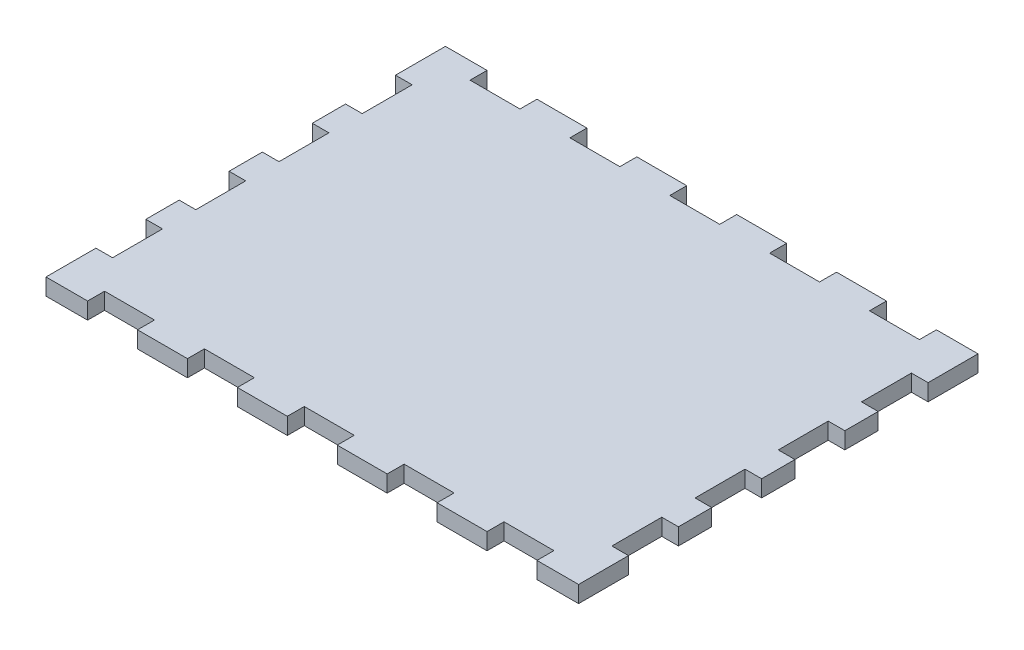
from build123d import *

# Parameters (mm, degrees)
SKETCH1_W               = 203.2
SKETCH1_H               = 152.4
BOSS_EXTRUDE1_DEPTH     = 3.175
SKETCH2_W               = 19.05
SKETCH2_H               = 6.477
CUT_EXTRUDE1_DEPTH      = 128.158650905
LPATTERN1_COUNT         = 5
LPATTERN1_PITCH         = 38.1
MIRROR1_COPY_1_SKETCH_W = 19.05
MIRROR1_COPY_1_SKETCH_H = 6.477
MIRROR1_COPY_1_DEPTH    = 128.158650905
MIRROR1_COPY_2_SKETCH_W = 19.05
MIRROR1_COPY_2_SKETCH_H = 6.477
MIRROR1_COPY_2_DEPTH    = 128.158650905
MIRROR1_COPY_3_SKETCH_W = 19.05
MIRROR1_COPY_3_SKETCH_H = 6.477
MIRROR1_COPY_3_DEPTH    = 128.158650905
MIRROR1_COPY_4_SKETCH_W = 19.05
MIRROR1_COPY_4_SKETCH_H = 6.477
MIRROR1_COPY_4_DEPTH    = 128.158650905
SKETCH3_W               = 6.35
SKETCH3_H               = 19.05
CUT_EXTRUDE2_DEPTH      = 128.158650905
LPATTERN2_COUNT         = 4
LPATTERN2_PITCH         = 31.75
MIRROR2_COPY_1_SKETCH_W = 6.35
MIRROR2_COPY_1_SKETCH_H = 19.05
MIRROR2_COPY_1_DEPTH    = 128.158650905
MIRROR2_COPY_2_SKETCH_W = 6.35
MIRROR2_COPY_2_SKETCH_H = 19.05
MIRROR2_COPY_2_DEPTH    = 128.158650905
MIRROR2_COPY_3_SKETCH_W = 6.35
MIRROR2_COPY_3_SKETCH_H = 19.05
MIRROR2_COPY_3_DEPTH    = 128.158650905


with BuildPart() as part:
    # Sketch1 → Boss-Extrude1 (new, symmetric)
    with BuildSketch(Plane(origin=(0, 0, 0), x_dir=(1, 0, 0), z_dir=(0, 1, 0))):
        Rectangle(SKETCH1_W, SKETCH1_H)
    extrude(amount=BOSS_EXTRUDE1_DEPTH, both=True)

    # Sketch2 → Cut-Extrude1 (cut, through all)
    with BuildSketch(Plane(origin=(0, 3.175, 0), x_dir=(1, 0, 0), z_dir=(0, 1, 0))):
        with Locations((76.2, 72.9615)):
            Rectangle(SKETCH2_W, SKETCH2_H)
    cut_extrude1 = extrude(amount=-CUT_EXTRUDE1_DEPTH, mode=Mode.SUBTRACT)

    # LPattern1: Cut-Extrude1 ×5
    with Locations(*[(-i * LPATTERN1_PITCH, 0, 0) for i in range(1, LPATTERN1_COUNT)]):
        add(cut_extrude1, mode=Mode.SUBTRACT)

    # Mirror1: Cut-Extrude1 across plane
    add(cut_extrude1.mirror(Plane.XY), mode=Mode.SUBTRACT)

    # Mirror1 copy 1 sketch → Mirror1 copy 1 (cut, through all)
    with BuildSketch(Plane(origin=(-38.1, 3.175, 0), x_dir=(1, 0, 0), z_dir=(0, 1, 0))):
        with Locations((76.2, -72.9615)):
            Rectangle(MIRROR1_COPY_1_SKETCH_W, MIRROR1_COPY_1_SKETCH_H)
    extrude(amount=-MIRROR1_COPY_1_DEPTH, mode=Mode.SUBTRACT)

    # Mirror1 copy 2 sketch → Mirror1 copy 2 (cut, through all)
    with BuildSketch(Plane(origin=(-76.2, 3.175, 0), x_dir=(1, 0, 0), z_dir=(0, 1, 0))):
        with Locations((76.2, -72.9615)):
            Rectangle(MIRROR1_COPY_2_SKETCH_W, MIRROR1_COPY_2_SKETCH_H)
    extrude(amount=-MIRROR1_COPY_2_DEPTH, mode=Mode.SUBTRACT)

    # Mirror1 copy 3 sketch → Mirror1 copy 3 (cut, through all)
    with BuildSketch(Plane(origin=(-114.3, 3.175, 0), x_dir=(1, 0, 0), z_dir=(0, 1, 0))):
        with Locations((76.2, -72.9615)):
            Rectangle(MIRROR1_COPY_3_SKETCH_W, MIRROR1_COPY_3_SKETCH_H)
    extrude(amount=-MIRROR1_COPY_3_DEPTH, mode=Mode.SUBTRACT)

    # Mirror1 copy 4 sketch → Mirror1 copy 4 (cut, through all)
    with BuildSketch(Plane(origin=(-152.4, 3.175, 0), x_dir=(1, 0, 0), z_dir=(0, 1, 0))):
        with Locations((76.2, -72.9615)):
            Rectangle(MIRROR1_COPY_4_SKETCH_W, MIRROR1_COPY_4_SKETCH_H)
    extrude(amount=-MIRROR1_COPY_4_DEPTH, mode=Mode.SUBTRACT)

    # Sketch3 → Cut-Extrude2 (cut, through all)
    with BuildSketch(Plane(origin=(0, 3.175, 0), x_dir=(1, 0, 0), z_dir=(0, 1, 0))):
        with Locations((-98.425, 47.625)):
            Rectangle(SKETCH3_W, SKETCH3_H)
    cut_extrude2 = extrude(amount=-CUT_EXTRUDE2_DEPTH, mode=Mode.SUBTRACT)

    # LPattern2: Cut-Extrude2 ×4
    with Locations(*[(0, 0, i * LPATTERN2_PITCH) for i in range(1, LPATTERN2_COUNT)]):
        add(cut_extrude2, mode=Mode.SUBTRACT)

    # Mirror2: Cut-Extrude2 across plane
    add(cut_extrude2.mirror(Plane(origin=(0, 0, 0), x_dir=(0, 0, 1), z_dir=(1, 0, 0))), mode=Mode.SUBTRACT)

    # Mirror2 copy 1 sketch → Mirror2 copy 1 (cut, through all)
    with BuildSketch(Plane(origin=(0, 3.175, 31.75), x_dir=(-1, 0, 0), z_dir=(0, 1, 0))):
        with Locations((-98.425, -47.625)):
            Rectangle(MIRROR2_COPY_1_SKETCH_W, MIRROR2_COPY_1_SKETCH_H)
    extrude(amount=-MIRROR2_COPY_1_DEPTH, mode=Mode.SUBTRACT)

    # Mirror2 copy 2 sketch → Mirror2 copy 2 (cut, through all)
    with BuildSketch(Plane(origin=(0, 3.175, 63.5), x_dir=(-1, 0, 0), z_dir=(0, 1, 0))):
        with Locations((-98.425, -47.625)):
            Rectangle(MIRROR2_COPY_2_SKETCH_W, MIRROR2_COPY_2_SKETCH_H)
    extrude(amount=-MIRROR2_COPY_2_DEPTH, mode=Mode.SUBTRACT)

    # Mirror2 copy 3 sketch → Mirror2 copy 3 (cut, through all)
    with BuildSketch(Plane(origin=(0, 3.175, 95.25), x_dir=(-1, 0, 0), z_dir=(0, 1, 0))):
        with Locations((-98.425, -47.625)):
            Rectangle(MIRROR2_COPY_3_SKETCH_W, MIRROR2_COPY_3_SKETCH_H)
    extrude(amount=-MIRROR2_COPY_3_DEPTH, mode=Mode.SUBTRACT)


solid = part.part
